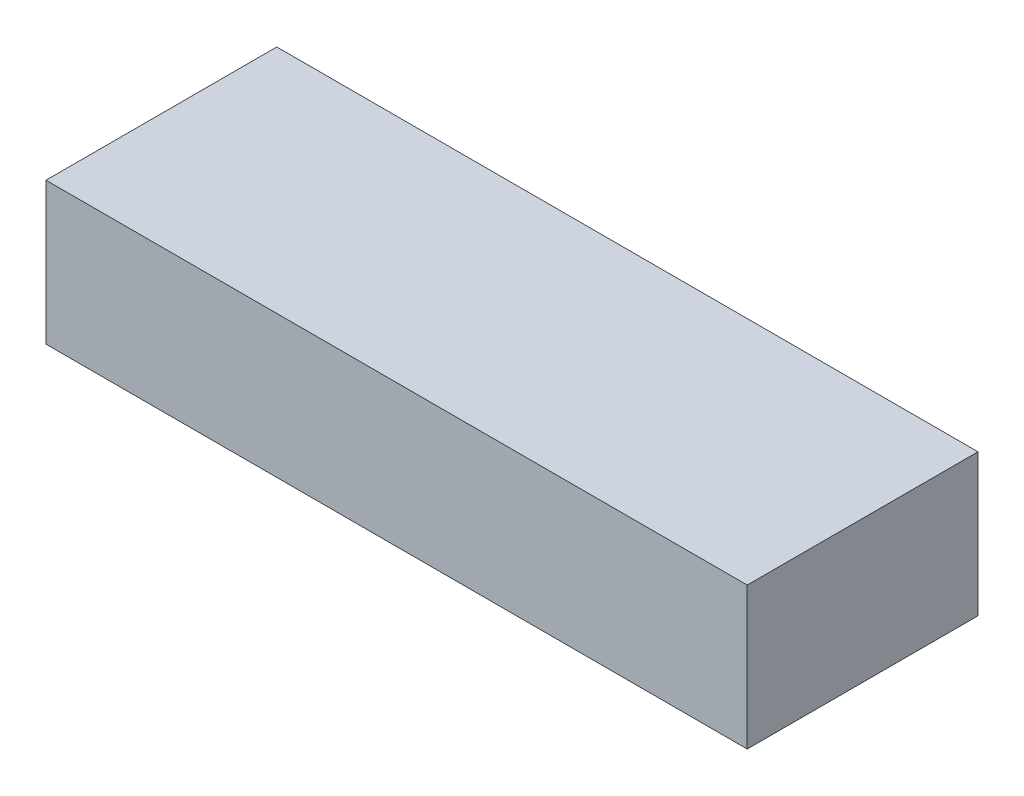
from build123d import *

# Parameters (mm, degrees)
SKETCH1_W           = 237
SKETCH1_H           = 78
BOSS_EXTRUDE1_DEPTH = 48


with BuildPart() as part:
    # Sketch1 → Boss-Extrude1 (new body)
    with BuildSketch(Plane(origin=(0, 0, 0), x_dir=(1, 0, 0), z_dir=(0, 1, 0))):
        Rectangle(SKETCH1_W, SKETCH1_H)
    extrude(amount=BOSS_EXTRUDE1_DEPTH)


solid = part.part
